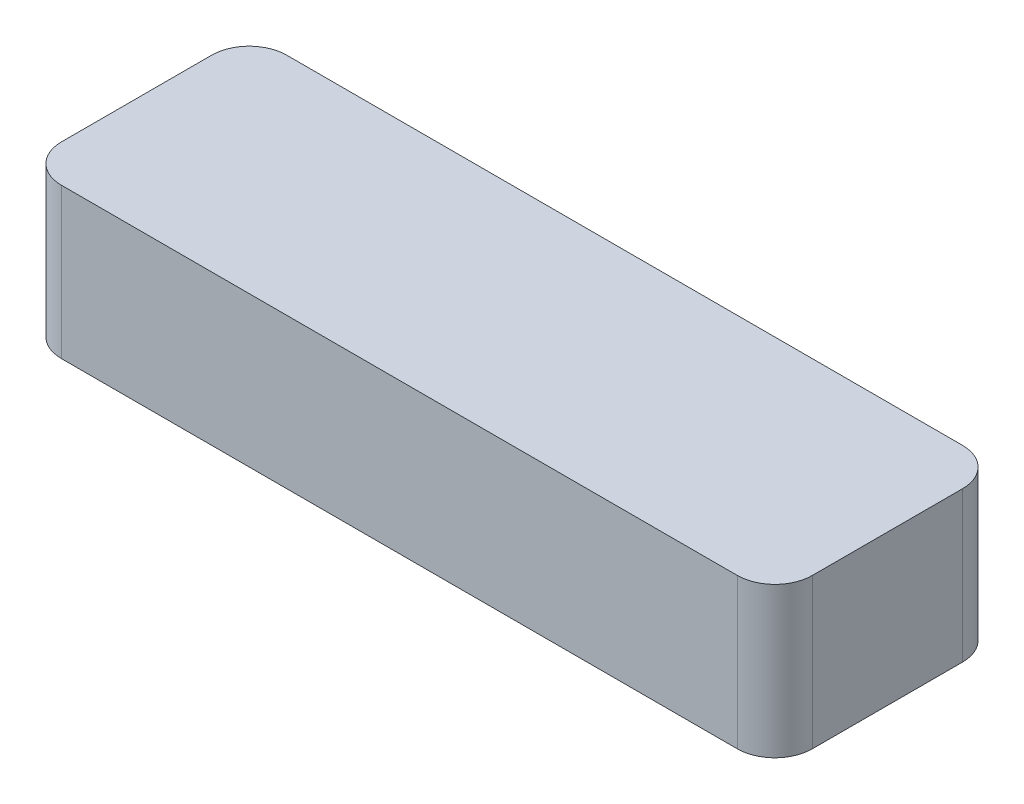
from build123d import *

# Parameters (mm, degrees)
BOSS_EXTRUDE2_DEPTH = 2


with BuildPart() as part:
    # Sketch1 → Boss-Extrude2 (new body)
    with BuildSketch(Plane(origin=(0, 0, 0), x_dir=(1, 0, 0), z_dir=(0, 1, 0))):
        with BuildLine():
            Line((-4.5, 1.5), (4.5, 1.5))
            ThreePointArc((4.5, 1.5), (4.853553391, 1.353553391), (5, 1))
            Line((5, 1), (5, -1))
            ThreePointArc((5, -1), (4.853553391, -1.353553391), (4.5, -1.5))
            Line((4.5, -1.5), (-4.5, -1.5))
            ThreePointArc((-4.5, -1.5), (-4.853553391, -1.353553391), (-5, -1))
            Line((-5, -1), (-5, 1))
            ThreePointArc((-5, 1), (-4.853553391, 1.353553391), (-4.5, 1.5))
        make_face()
    extrude(amount=BOSS_EXTRUDE2_DEPTH)


solid = part.part
